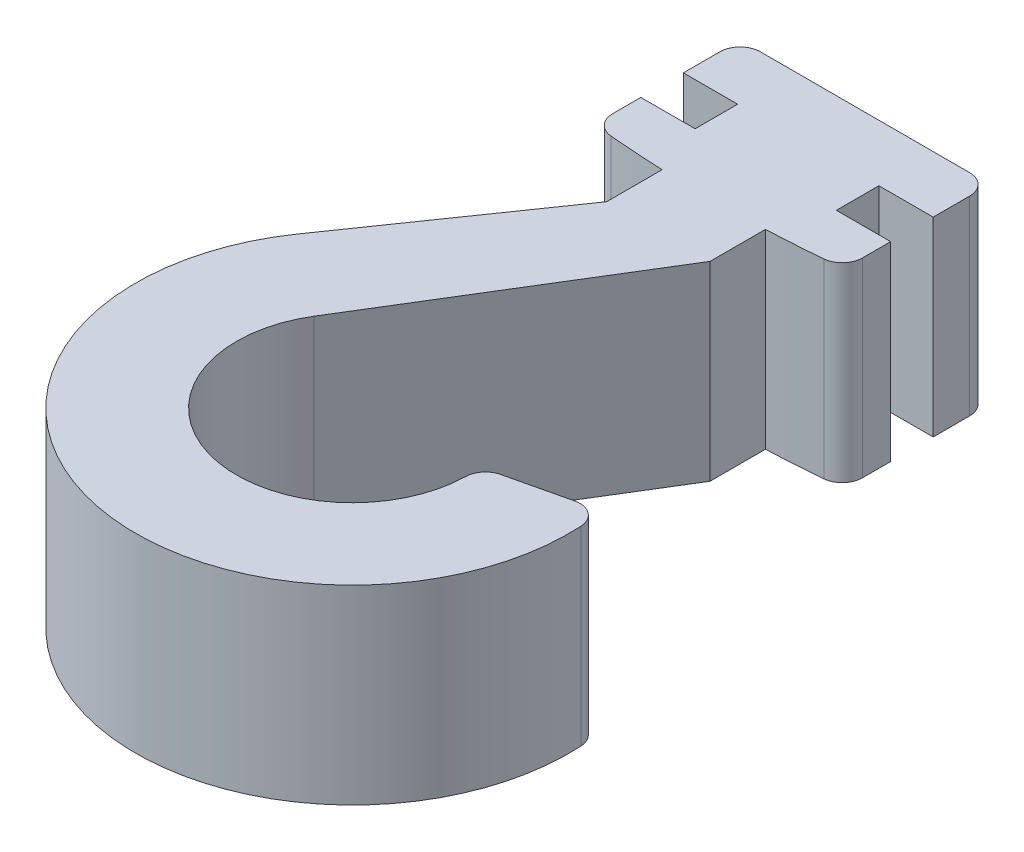
from build123d import *

# Parameters (mm, degrees)
ESTRUSIONE_ESTRUSIONE1_DEPTH = 9.4
RACCORDO1_R                  = 1


with BuildPart() as part:
    # Schizzo1 → Estrusione-Estrusione1 (new body)
    with BuildSketch(Plane(origin=(0, 0, 0), x_dir=(1, 0, 0), z_dir=(0, 1, 0))):
        with BuildLine():
            Line((-2.361490309, 17.420855221), (-14.691490309, 17.420855221))
            Line((-14.691490309, 17.420855221), (-14.691490309, 14.620855221))
            Line((-14.691490309, 14.620855221), (-12.011490309, 14.620855221))
            Line((-12.011490309, 14.620855221), (-12.011490309, 12.520855221))
            Line((-12.011490309, 12.520855221), (-14.691490309, 12.520855221))
            Line((-14.691490309, 12.520855221), (-14.691490309, 10.220855221))
            ThreePointArc((-14.691490309, 10.220855221), (-12.885979413, 10.061873727), (-11.076490309, 9.957499929))
            Line((-11.076490309, 9.957499929), (-11.076490309, 7.220855221))
            Line((-11.076490309, 7.220855221), (-17.319309854, -1.781905696))
            ThreePointArc((-17.319309854, -1.781905696), (-10.857687466, -18.322109867), (2.024570257, -6.100066099))
            Line((2.024570257, -6.100066099), (-2.842159863, -7.246773536))
            ThreePointArc((-2.842159863, -7.246773536), (-9.772569078, -13.461151023), (-13.402257337, -4.889428758))
            Line((-13.402257337, -4.889428758), (-5.976490309, 7.220855221))
            Line((-5.976490309, 7.220855221), (-5.976490309, 9.957499929))
            ThreePointArc((-5.976490309, 9.957499929), (-4.167001204, 10.061873727), (-2.361490309, 10.220855221))
            Line((-2.361490309, 10.220855221), (-2.361490309, 12.520855221))
            Line((-2.361490309, 12.520855221), (-5.041490309, 12.520855221))
            Line((-5.041490309, 12.520855221), (-5.041490309, 14.620855221))
            Line((-5.041490309, 14.620855221), (-2.361490309, 14.620855221))
            Line((-2.361490309, 14.620855221), (-2.361490309, 17.420855221))
        make_face()
    extrude(amount=ESTRUSIONE_ESTRUSIONE1_DEPTH)

    # Raccordo1
    raccordo1_edges = [part.edges().sort_by_distance(p)[0] for p in [
        (-2.361490309, 4.7, -17.420855221),
        (-14.691490309, 4.7, -17.420855221),
        (-2.842159863, 4.7, 7.246773536),
        (2.024570257, 4.7, 6.100066099),
        (-2.361490309, 4.7, -10.220855221),
        (-14.691490309, 4.7, -10.220855221),
    ]]
    fillet(raccordo1_edges, radius=RACCORDO1_R)


solid = part.part
